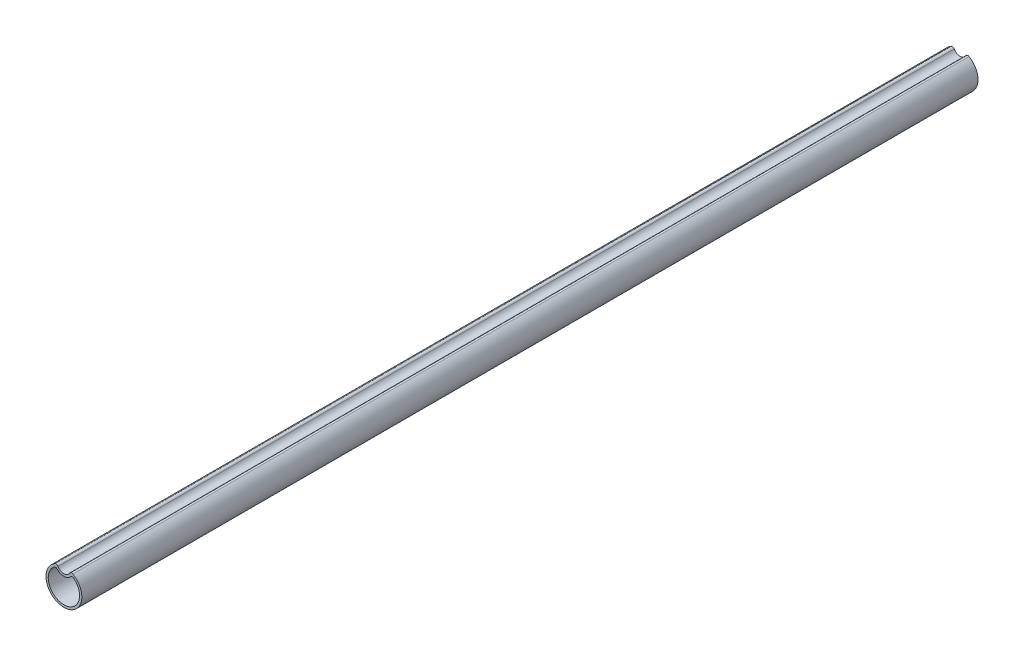
from build123d import *

# Parameters (mm, degrees)
ESTRUSIONE_ESTRUSIONE1_DEPTH = 200
SCHIZZO2_R                   = 1.5
TAGLIO_ESTRUSIONE1_DEPTH     = 200
SCHIZZO3_R                   = 1
TAGLIO_ESTRUSIONE2_DEPTH     = 200


with BuildPart() as part:
    # Schizzo1 → Estrusione-Estrusione1 (new body)
    with BuildSketch(Plane.XY):
        with BuildLine():
            ThreePointArc((-1.999681097, 3.464285714), (0, -4), (1.999681097, 3.464285714))
            ThreePointArc((1.999681097, 3.464285714), (1.615959904, 3.513025861), (1.31229072, 3.2734375))
            ThreePointArc((1.31229072, 3.2734375), (0, 2.5), (-1.31229072, 3.2734375))
            ThreePointArc((-1.31229072, 3.2734375), (-1.615959904, 3.513025861), (-1.999681097, 3.464285714))
        make_face()
        with BuildLine():
            ThreePointArc((-2.184763914, 2.734375), (0, -3.5), (2.184763914, 2.734375))
            ThreePointArc((2.184763914, 2.734375), (1.829579631, 2.841891076), (1.498123827, 2.675))
            ThreePointArc((1.498123827, 2.675), (0, 2), (-1.498123827, 2.675))
            ThreePointArc((-1.498123827, 2.675), (-1.829579631, 2.841891076), (-2.184763914, 2.734375))
        make_face(mode=Mode.SUBTRACT)
    extrude(amount=ESTRUSIONE_ESTRUSIONE1_DEPTH)

    # Schizzo2 → Taglio-Estrusione1 (cut)
    with BuildSketch(Plane(origin=(0, 0, 0), x_dir=(0, 0, -1), z_dir=(1, 0, 0))):
        with Locations((-7, 0)):
            Circle(SCHIZZO2_R)
        with BuildLine():
            Line((-183, 1), (-177, 1))
            ThreePointArc((-177, 1), (-176, 0), (-177, -1))
            Line((-177, -1), (-183, -1))
            ThreePointArc((-183, -1), (-184, 0), (-183, 1))
        make_face()
    extrude(amount=-TAGLIO_ESTRUSIONE1_DEPTH, mode=Mode.SUBTRACT)

    # Schizzo3 → Taglio-Estrusione2 (cut)
    with BuildSketch(Plane(origin=(0, 0, 0), x_dir=(1, 0, 0), z_dir=(0, 1, 0))):
        with Locations((0, -190)):
            Circle(SCHIZZO3_R)
    extrude(amount=-TAGLIO_ESTRUSIONE2_DEPTH, mode=Mode.SUBTRACT)


solid = part.part
